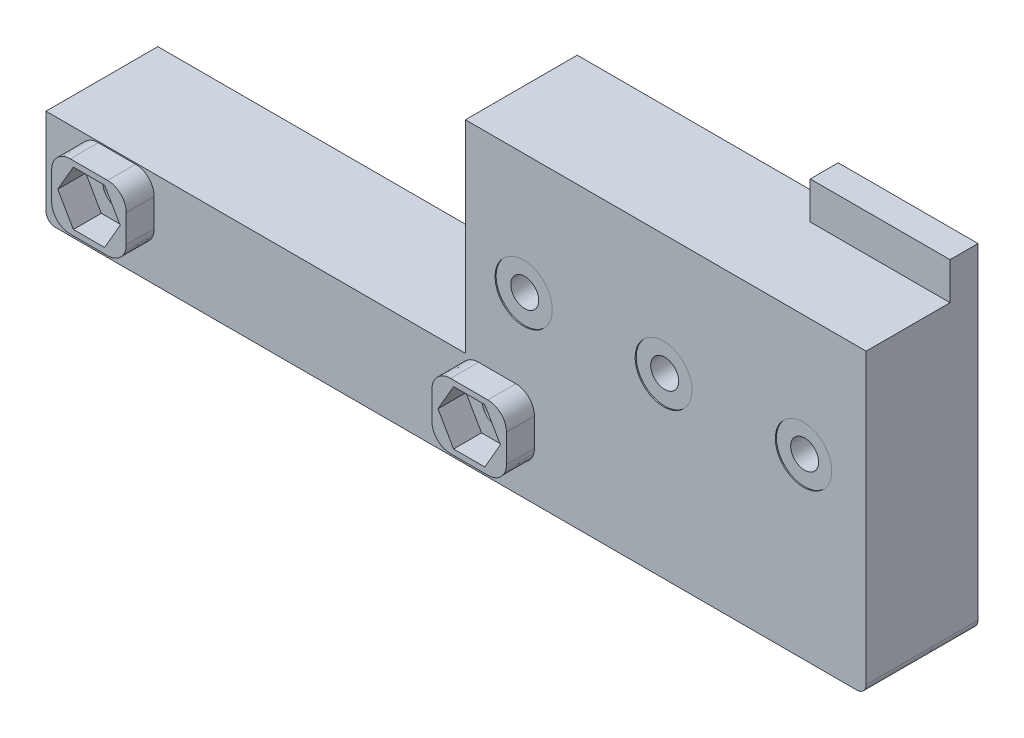
from build123d import *

# Parameters (mm, degrees)
SKETCH3_R            = 3.071511102
SKETCH3_R_2          = 3.049098112
SKETCH3_R_3          = 3.026830266
BOSS_EXTRUDE4_DEPTH  = 7
BOSS_EXTRUDE5_DEPTH  = 10
SKETCH3_9_R          = 1.5
BOSS_EXTRUDE8_DEPTH  = 7
FILLET3_R            = 1
SKETCH3_11_R         = 1.5
BOSS_EXTRUDE10_DEPTH = 7
BOSS_EXTRUDE11_START = -3
SKETCH4_R            = 3.071511102
SKETCH4_R_2          = 1.5
SKETCH4_R_3          = 3.049098112
SKETCH4_R_4          = 3.026830266
BOSS_EXTRUDE11_DEPTH = 3
BOSS_EXTRUDE12_START = -5
SKETCH2_R            = 1.5
BOSS_EXTRUDE12_DEPTH = 5
CUT_EXTRUDE2_START   = -5
SKETCH3_14_R         = 3.071511102
SKETCH3_14_R_2       = 1.5
SKETCH3_14_R_3       = 3.049098112
SKETCH3_14_R_4       = 3.026830266
CUT_EXTRUDE2_DEPTH   = 5
SKETCH3_15_R         = 3.071511102
SKETCH3_15_R_2       = 1.5
SKETCH3_15_R_3       = 3.049098112
SKETCH3_15_R_4       = 3.026830266
BOSS_EXTRUDE13_DEPTH = 5
FILLET4_R            = 1
SKETCH5_W            = 43
SKETCH5_H            = 12
BOSS_EXTRUDE14_DEPTH = 4.5
SKETCH6_W            = 3
SKETCH6_H            = 4
BOSS_EXTRUDE15_DEPTH = 15


with BuildPart() as part:
    # Sketch3 → Boss-Extrude4 (new body)
    with BuildSketch(Plane.XY.offset(-78.887933846)):
        Polygon((241.7237854, -135.515258789), (196.7237854, -135.515258789), (196.7237854, -145.811340332), (284.7237854, -145.811340332), (284.7237854, -118.311340332), (241.7237854, -118.311355591), align=None)
        with BuildLine():
            Line((202.333740234, -135.638763428), (206.333740234, -135.638763428))
            add(Edge.make_bspline(
                [(208.333740234, -137.638763428), (208.333786551, -137.477652798), (208.304360012, -137.236015107), (208.208324965, -136.927827264), (208.108957041, -136.707056776), (207.983714409, -136.4998655), (207.834398535, -136.309288011), (207.663206588, -136.138093583), (207.472631269, -135.988786754), (207.265444017, -135.863541762), (207.044668555, -135.76418574), (206.736485734, -135.668137164), (206.494849845, -135.638720059), (206.333740234, -135.638763428)],
                knots=[0, 0, 0, 0, 0.153843885, 0.230771192, 0.307692708, 0.384614356, 0.461541819, 0.538465212, 0.615385852, 0.6923075, 0.769233448, 0.846156115, 1, 1, 1, 1], degree=3))
            Line((208.333740234, -137.638763428), (208.333740234, -140.638763428))
            add(Edge.make_bspline(
                [(206.333740234, -142.638763428), (206.494851569, -142.638812668), (206.736480774, -142.609378133), (207.044670851, -142.513359722), (207.265448484, -142.414001964), (207.472626549, -142.288737745), (207.663208089, -142.139434935), (207.834392335, -141.968239016), (207.98372428, -141.777673404), (208.108952276, -141.570471992), (208.208322321, -141.34970416), (208.304366785, -141.04151848), (208.3337818, -140.799878105), (208.333740234, -140.638763428)],
                knots=[0, 0, 0, 0, 0.153843648, 0.23076475, 0.307690579, 0.384614623, 0.461535145, 0.538458419, 0.615381937, 0.692307626, 0.769229024, 0.846151572, 1, 1, 1, 1], degree=3))
            Line((206.333740234, -142.638763428), (202.333740234, -142.638763428))
            add(Edge.make_bspline(
                [(200.333740234, -140.638763428), (200.33367962, -140.799878701), (200.363098614, -141.041519271), (200.459144013, -141.349703337), (200.558509164, -141.570477522), (200.683760458, -141.777663476), (200.833070439, -141.968244679), (201.004258341, -142.139434104), (201.19483844, -142.288737632), (201.402016388, -142.414003248), (201.622797313, -142.513355322), (201.93098344, -142.60940701), (202.172625437, -142.638823061), (202.333740234, -142.638763428)],
                knots=[0, 0, 0, 0, 0.153847342, 0.230769493, 0.307690494, 0.3846183, 0.461538425, 0.538461302, 0.615381427, 0.692305075, 0.769230507, 0.846152658, 1, 1, 1, 1], degree=3))
            Line((200.333740234, -140.638763428), (200.333740234, -137.638763428))
            add(Edge.make_bspline(
                [(202.333740234, -135.638763428), (202.172626031, -135.638722842), (201.930984234, -135.668134916), (201.622796485, -135.764185666), (201.402021935, -135.863542645), (201.194828451, -135.988784921), (201.004264234, -136.138110572), (200.83306875, -136.309295747), (200.683766235, -136.499877171), (200.558500403, -136.707054773), (200.459148182, -136.927835754), (200.363099055, -137.236017253), (200.333677741, -137.477653162), (200.333740234, -137.638763428)],
                knots=[0, 0, 0, 0, 0.153848209, 0.230770648, 0.307696367, 0.384617787, 0.461541196, 0.53846436, 0.615384772, 0.692308707, 0.769234426, 0.846156865, 1, 1, 1, 1], degree=3))
        make_face(mode=Mode.SUBTRACT)
        with BuildLine():
            Line((243.131362915, -135.640258789), (247.131362915, -135.640258789))
            add(Edge.make_bspline(
                [(249.131362915, -137.640258789), (249.131404103, -137.479144365), (249.101990222, -137.237503231), (249.005943868, -136.929318816), (248.906581, -136.708551356), (248.781335382, -136.501366051), (248.63203731, -136.310779003), (248.460842685, -136.139584426), (248.270255688, -135.99028621), (248.063070227, -135.865041119), (247.842298902, -135.765674289), (247.534111353, -135.669638858), (247.292473486, -135.64021255), (247.131362915, -135.640258789)],
                knots=[0, 0, 0, 0, 0.153848484, 0.230771061, 0.307692486, 0.384614044, 0.461538419, 0.538461721, 0.615386097, 0.692307654, 0.76922908, 0.846156296, 1, 1, 1, 1], degree=3))
            Line((249.131362915, -137.640258789), (249.131362915, -140.640258789))
            add(Edge.make_bspline(
                [(247.131362915, -142.640258789), (247.292473885, -142.640304371), (247.534110555, -142.610880035), (247.8423001, -142.514841317), (248.063065737, -142.415483854), (248.270272451, -142.290203759), (248.524051883, -142.091494389), (248.739873863, -141.847855516), (248.906555547, -141.571986273), (249.005950655, -141.351193415), (249.101985697, -141.043017912), (249.131406366, -140.801371431), (249.131362915, -140.640258789)],
                knots=[0, 0, 0, 0, 0.153886926, 0.230835755, 0.307778791, 0.38472196, 0.461667947, 0.6152779, 0.692221069, 0.769164105, 0.846108292, 1, 1, 1, 1], degree=3))
            Line((247.131362915, -142.640258789), (243.131362915, -142.640258789))
            Line((243.131362915, -142.640258789), (242.890289307, -142.625671387))
            Line((242.890289307, -142.625671387), (242.65272522, -142.582138062))
            add(Edge.make_bspline(
                [(241.131362915, -140.640258789), (241.131302298, -140.801374067), (241.160721302, -141.043014624), (241.256766684, -141.351198712), (241.356131884, -141.571972833), (241.481382994, -141.779159023), (241.63069366, -141.969739347), (241.801881842, -142.14093489), (241.992475128, -142.290228107), (242.26870618, -142.457251952), (242.496282789, -142.543643375), (242.65272522, -142.582138062)],
                knots=[0, 0, 0, 0, 0.181820282, 0.272728627, 0.363635612, 0.45455064, 0.545456591, 0.636365793, 0.727276265, 0.818186378, 1, 1, 1, 1], degree=3))
            Line((241.131362915, -140.640258789), (241.145935059, -137.399185181))
            add(Edge.make_bspline(
                [(243.131362915, -135.640258789), (242.970248964, -135.64021858), (242.728606411, -135.669629524), (242.420419921, -135.765682158), (242.199645762, -135.865031975), (241.992468308, -135.990291817), (241.801882944, -136.1395838), (241.630687723, -136.310778592), (241.481392209, -136.501370397), (241.356129478, -136.708547293), (241.223632459, -137.002908059), (241.165339975, -137.239248061), (241.145935059, -137.399185181)],
                knots=[0, 0, 0, 0, 0.166668849, 0.250001468, 0.333337642, 0.416664652, 0.499999221, 0.583332627, 0.666667195, 0.750001435, 0.833332808, 1, 1, 1, 1], degree=3))
        make_face(mode=Mode.SUBTRACT)
        with Locations((247.975942303, -126.797841972)):
            Circle(SKETCH3_R, mode=Mode.SUBTRACT)
        with Locations((262.988003667, -126.797841972)):
            Circle(SKETCH3_R_2, mode=Mode.SUBTRACT)
        with Locations((278.005868037, -126.797841972)):
            Circle(SKETCH3_R_3, mode=Mode.SUBTRACT)
    extrude(amount=BOSS_EXTRUDE4_DEPTH)

    # Sketch3<6> → Boss-Extrude5 (add)
    # profile 1 of 2: a face of its own
    with BuildSketch(Plane.XY.offset(-78.887933846)):
        with BuildLine():
            add(Edge.make_bspline(
                [(249.131362915, -137.640258789), (249.131404103, -137.479144365), (249.101990222, -137.237503231), (249.005943868, -136.929318816), (248.906581, -136.708551356), (248.781335382, -136.501366051), (248.63203731, -136.310779003), (248.460842685, -136.139584426), (248.270255688, -135.99028621), (248.063070227, -135.865041119), (247.842298902, -135.765674289), (247.534111353, -135.669638858), (247.292473486, -135.64021255), (247.131362915, -135.640258789)],
                knots=[0, 0, 0, 0, 0.153848484, 0.230771061, 0.307692486, 0.384614044, 0.461538419, 0.538461721, 0.615386097, 0.692307654, 0.76922908, 0.846156296, 1, 1, 1, 1], degree=3))
            Line((247.131362915, -135.640258789), (243.131362915, -135.640258789))
            add(Edge.make_bspline(
                [(243.131362915, -135.640258789), (242.970248964, -135.64021858), (242.728606411, -135.669629524), (242.420419921, -135.765682158), (242.199645762, -135.865031975), (241.992468308, -135.990291817), (241.801882944, -136.1395838), (241.630687723, -136.310778592), (241.481392209, -136.501370397), (241.356129478, -136.708547293), (241.223632459, -137.002908059), (241.165339975, -137.239248061), (241.145935059, -137.399185181)],
                knots=[0, 0, 0, 0, 0.166668849, 0.250001468, 0.333337642, 0.416664652, 0.499999221, 0.583332627, 0.666667195, 0.750001435, 0.833332808, 1, 1, 1, 1], degree=3))
            Line((241.145935059, -137.399185181), (241.131362915, -140.640258789))
            add(Edge.make_bspline(
                [(241.131362915, -140.640258789), (241.131302298, -140.801374067), (241.160721302, -141.043014624), (241.256766684, -141.351198712), (241.356131884, -141.571972833), (241.481382994, -141.779159023), (241.63069366, -141.969739347), (241.801881842, -142.14093489), (241.992475128, -142.290228107), (242.26870618, -142.457251952), (242.496282789, -142.543643375), (242.65272522, -142.582138062)],
                knots=[0, 0, 0, 0, 0.181820282, 0.272728627, 0.363635612, 0.45455064, 0.545456591, 0.636365793, 0.727276265, 0.818186378, 1, 1, 1, 1], degree=3))
            Line((242.65272522, -142.582138062), (242.890289307, -142.625671387))
            Line((242.890289307, -142.625671387), (243.131362915, -142.640258789))
            Line((243.131362915, -142.640258789), (247.131362915, -142.640258789))
            add(Edge.make_bspline(
                [(247.131362915, -142.640258789), (247.292473885, -142.640304371), (247.534110555, -142.610880035), (247.8423001, -142.514841317), (248.063065737, -142.415483854), (248.270272451, -142.290203759), (248.524051883, -142.091494389), (248.739873863, -141.847855516), (248.906555547, -141.571986273), (249.005950655, -141.351193415), (249.101985697, -141.043017912), (249.131406366, -140.801371431), (249.131362915, -140.640258789)],
                knots=[0, 0, 0, 0, 0.153886926, 0.230835755, 0.307778791, 0.38472196, 0.461667947, 0.6152779, 0.692221069, 0.769164105, 0.846108292, 1, 1, 1, 1], degree=3))
            Line((249.131362915, -140.640258789), (249.131362915, -137.640258789))
        make_face()
        Polygon((246.805679321, -136.240264893), (248.479995728, -139.140258789), (246.805679321, -142.040252686), (243.457046509, -142.040267944), (241.782730103, -139.140258789), (243.457046509, -136.240264893), align=None, mode=Mode.SUBTRACT)
    # profile 2 of 2: a face of its own
    with BuildSketch(Plane.XY.offset(-78.887933846)):
        with BuildLine():
            add(Edge.make_bspline(
                [(208.333740234, -137.638763428), (208.333786551, -137.477652798), (208.304360012, -137.236015107), (208.208324965, -136.927827264), (208.108957041, -136.707056776), (207.983714409, -136.4998655), (207.834398535, -136.309288011), (207.663206588, -136.138093583), (207.472631269, -135.988786754), (207.265444017, -135.863541762), (207.044668555, -135.76418574), (206.736485734, -135.668137164), (206.494849845, -135.638720059), (206.333740234, -135.638763428)],
                knots=[0, 0, 0, 0, 0.153843885, 0.230771192, 0.307692708, 0.384614356, 0.461541819, 0.538465212, 0.615385852, 0.6923075, 0.769233448, 0.846156115, 1, 1, 1, 1], degree=3))
            Line((206.333740234, -135.638763428), (202.333740234, -135.638763428))
            add(Edge.make_bspline(
                [(202.333740234, -135.638763428), (202.172626031, -135.638722842), (201.930984234, -135.668134916), (201.622796485, -135.764185666), (201.402021935, -135.863542645), (201.194828451, -135.988784921), (201.004264234, -136.138110572), (200.83306875, -136.309295747), (200.683766235, -136.499877171), (200.558500403, -136.707054773), (200.459148182, -136.927835754), (200.363099055, -137.236017253), (200.333677741, -137.477653162), (200.333740234, -137.638763428)],
                knots=[0, 0, 0, 0, 0.153848209, 0.230770648, 0.307696367, 0.384617787, 0.461541196, 0.53846436, 0.615384772, 0.692308707, 0.769234426, 0.846156865, 1, 1, 1, 1], degree=3))
            Line((200.333740234, -137.638763428), (200.333740234, -140.638763428))
            add(Edge.make_bspline(
                [(200.333740234, -140.638763428), (200.33367962, -140.799878701), (200.363098614, -141.041519271), (200.459144013, -141.349703337), (200.558509164, -141.570477522), (200.683760458, -141.777663476), (200.833070439, -141.968244679), (201.004258341, -142.139434104), (201.19483844, -142.288737632), (201.402016388, -142.414003248), (201.622797313, -142.513355322), (201.93098344, -142.60940701), (202.172625437, -142.638823061), (202.333740234, -142.638763428)],
                knots=[0, 0, 0, 0, 0.153847342, 0.230769493, 0.307690494, 0.3846183, 0.461538425, 0.538461302, 0.615381427, 0.692305075, 0.769230507, 0.846152658, 1, 1, 1, 1], degree=3))
            Line((202.333740234, -142.638763428), (206.333740234, -142.638763428))
            add(Edge.make_bspline(
                [(206.333740234, -142.638763428), (206.494851569, -142.638812668), (206.736480774, -142.609378133), (207.044670851, -142.513359722), (207.265448484, -142.414001964), (207.472626549, -142.288737745), (207.663208089, -142.139434935), (207.834392335, -141.968239016), (207.98372428, -141.777673404), (208.108952276, -141.570471992), (208.208322321, -141.34970416), (208.304366785, -141.04151848), (208.3337818, -140.799878105), (208.333740234, -140.638763428)],
                knots=[0, 0, 0, 0, 0.153843648, 0.23076475, 0.307690579, 0.384614623, 0.461535145, 0.538458419, 0.615381937, 0.692307626, 0.769229024, 0.846151572, 1, 1, 1, 1], degree=3))
            Line((208.333740234, -140.638763428), (208.333740234, -137.638763428))
        make_face()
        Polygon((202.659423828, -136.238769531), (206.008056641, -136.238769531), (207.682373047, -139.138763428), (206.008056641, -142.038772583), (202.659423828, -142.038772583), (200.985107422, -139.138763428), align=None, mode=Mode.SUBTRACT)
    extrude(amount=BOSS_EXTRUDE5_DEPTH)

    # Sketch3<9> → Boss-Extrude8 (add)
    with BuildSketch(Plane.XY.offset(-78.887933846)):
        Polygon((246.805679321, -142.040252686), (248.479995728, -139.140258789), (246.805679321, -136.240264893), (243.457046509, -136.240264893), (241.782730103, -139.140258789), (243.457046509, -142.040267944), align=None)
        with Locations((245.03789158, -139.10308916)):
            Circle(SKETCH3_9_R, mode=Mode.SUBTRACT)
    extrude(amount=BOSS_EXTRUDE8_DEPTH)

    # Fillet3
    fillet3_edges = [part.edges().sort_by_distance(p)[0] for p in [
        (284.7237854, -145.811340332, -75.387933846),
        (196.7237854, -145.811340332, -75.387933846),
    ]]
    fillet(fillet3_edges, radius=FILLET3_R)

    # Sketch3<11> → Boss-Extrude10 (add)
    with BuildSketch(Plane.XY.offset(-78.887933846)):
        Polygon((207.682373047, -139.138763428), (206.008056641, -136.238769531), (202.659423828, -136.238769531), (200.985107422, -139.138763428), (202.659423828, -142.038772583), (206.008056641, -142.038772583), align=None)
        with Locations((204.345312661, -139.185131247)):
            Circle(SKETCH3_11_R, mode=Mode.SUBTRACT)
    extrude(amount=BOSS_EXTRUDE10_DEPTH)

    # Sketch4 → Boss-Extrude11 (add)
    # profile 1 of 3: a face of its own
    with BuildSketch(Plane.XY.offset(-72.005930691).offset(BOSS_EXTRUDE11_START)):
        with Locations((247.975942303, -126.797841972)):
            Circle(SKETCH4_R)
        with Locations((247.975942303, -126.797841972)):
            Circle(SKETCH4_R_2, mode=Mode.SUBTRACT)
    # profile 2 of 3: a face of its own
    with BuildSketch(Plane.XY.offset(-72.005930691).offset(BOSS_EXTRUDE11_START)):
        with Locations((262.988003667, -126.797841972)):
            Circle(SKETCH4_R_3)
        with Locations((262.988003667, -126.797841972)):
            Circle(SKETCH4_R_2, mode=Mode.SUBTRACT)
    # profile 3 of 3: a face of its own
    with BuildSketch(Plane.XY.offset(-72.005930691).offset(BOSS_EXTRUDE11_START)):
        with Locations((278.005868037, -126.797841972)):
            Circle(SKETCH4_R_4)
        with Locations((278.005868037, -126.797841972)):
            Circle(SKETCH4_R_2, mode=Mode.SUBTRACT)
    extrude(amount=BOSS_EXTRUDE11_DEPTH)

    # Sketch2 → Boss-Extrude12 (add)
    with BuildSketch(Plane.XY.offset(-78.887933846).offset(BOSS_EXTRUDE12_START)):
        Polygon((284.7237854, -118.311340332), (241.7237854, -118.311355591), (241.7237854, -135.515258789), (196.7237854, -135.515258789), (196.7237854, -145.811340332), (284.7237854, -145.811340332), align=None)
        with Locations((278.005868037, -126.797841972)):
            Circle(SKETCH2_R, mode=Mode.SUBTRACT)
        with Locations((262.988003667, -126.797841972)):
            Circle(SKETCH2_R, mode=Mode.SUBTRACT)
        with Locations((247.975942303, -126.797841972)):
            Circle(SKETCH2_R, mode=Mode.SUBTRACT)
        with Locations((245.03789158, -139.10308916)):
            Circle(SKETCH2_R, mode=Mode.SUBTRACT)
        with Locations((204.345312661, -139.185131247)):
            Circle(SKETCH2_R, mode=Mode.SUBTRACT)
    extrude(amount=BOSS_EXTRUDE12_DEPTH)

    # Sketch3<14> → Cut-Extrude2 (cut)
    # profile 1 of 3: a face of its own
    with BuildSketch(Plane.XY.offset(-78.887933846).offset(CUT_EXTRUDE2_START)):
        with Locations((247.975942303, -126.797841972)):
            Circle(SKETCH3_14_R)
        with Locations((247.975942303, -126.797841972)):
            Circle(SKETCH3_14_R_2, mode=Mode.SUBTRACT)
    # profile 2 of 3: a face of its own
    with BuildSketch(Plane.XY.offset(-78.887933846).offset(CUT_EXTRUDE2_START)):
        with Locations((262.988003667, -126.797841972)):
            Circle(SKETCH3_14_R_3)
        with Locations((262.988003667, -126.797841972)):
            Circle(SKETCH3_14_R_2, mode=Mode.SUBTRACT)
    # profile 3 of 3: a face of its own
    with BuildSketch(Plane.XY.offset(-78.887933846).offset(CUT_EXTRUDE2_START)):
        with Locations((278.005868037, -126.797841972)):
            Circle(SKETCH3_14_R_4)
        with Locations((278.005868037, -126.797841972)):
            Circle(SKETCH3_14_R_2, mode=Mode.SUBTRACT)
    extrude(amount=CUT_EXTRUDE2_DEPTH, mode=Mode.SUBTRACT)

    # Sketch3<15> → Boss-Extrude13 (add)
    # profile 1 of 3: a face of its own
    with BuildSketch(Plane.XY.offset(-78.887933846)):
        with Locations((247.975942303, -126.797841972)):
            Circle(SKETCH3_15_R)
        with Locations((247.975942303, -126.797841972)):
            Circle(SKETCH3_15_R_2, mode=Mode.SUBTRACT)
    # profile 2 of 3: a face of its own
    with BuildSketch(Plane.XY.offset(-78.887933846)):
        with Locations((262.988003667, -126.797841972)):
            Circle(SKETCH3_15_R_3)
        with Locations((262.988003667, -126.797841972)):
            Circle(SKETCH3_15_R_2, mode=Mode.SUBTRACT)
    # profile 3 of 3: a face of its own
    with BuildSketch(Plane.XY.offset(-78.887933846)):
        with Locations((278.005868037, -126.797841972)):
            Circle(SKETCH3_15_R_4)
        with Locations((278.005868037, -126.797841972)):
            Circle(SKETCH3_15_R_2, mode=Mode.SUBTRACT)
    extrude(amount=BOSS_EXTRUDE13_DEPTH)

    # Fillet4
    fillet4_edges = [part.edges().sort_by_distance(p)[0] for p in [
        (196.7237854, -145.811340332, -81.387933846),
        (284.7237854, -145.811340332, -81.387933846),
    ]]
    fillet(fillet4_edges, radius=FILLET4_R)

    # Sketch5 → Boss-Extrude14 (add)
    with BuildSketch(Plane(origin=(4.1983e-05, -118.311441368, 0), x_dir=(0.9999999999999372, 3.548555596652948e-07, 0), z_dir=(-3.548555596652948e-07, 0.9999999999999372, 0))):
        with Locations((263.223743417, 77.887933846)):
            Rectangle(SKETCH5_W, SKETCH5_H)
    extrude(amount=BOSS_EXTRUDE14_DEPTH)


with BuildPart() as boss_extrude15_tool:
    # Sketch6 → Boss-Extrude15 (new body)
    with BuildSketch(Plane(origin=(284.7237854, 0, 0), x_dir=(0, 0, -1), z_dir=(1, 0, 0))):
        with Locations((82.387933846, -111.811340332)):
            Rectangle(SKETCH6_W, SKETCH6_H)
    extrude(amount=-BOSS_EXTRUDE15_DEPTH)


with BuildPart() as part_1:
    add(part.part)


with BuildPart() as part_2:
    # Boss-Extrude15: joined with boss_extrude15_tool
    add(part_1.part.fuse(boss_extrude15_tool.part, tol=0.00001))


solid = part_2.part
